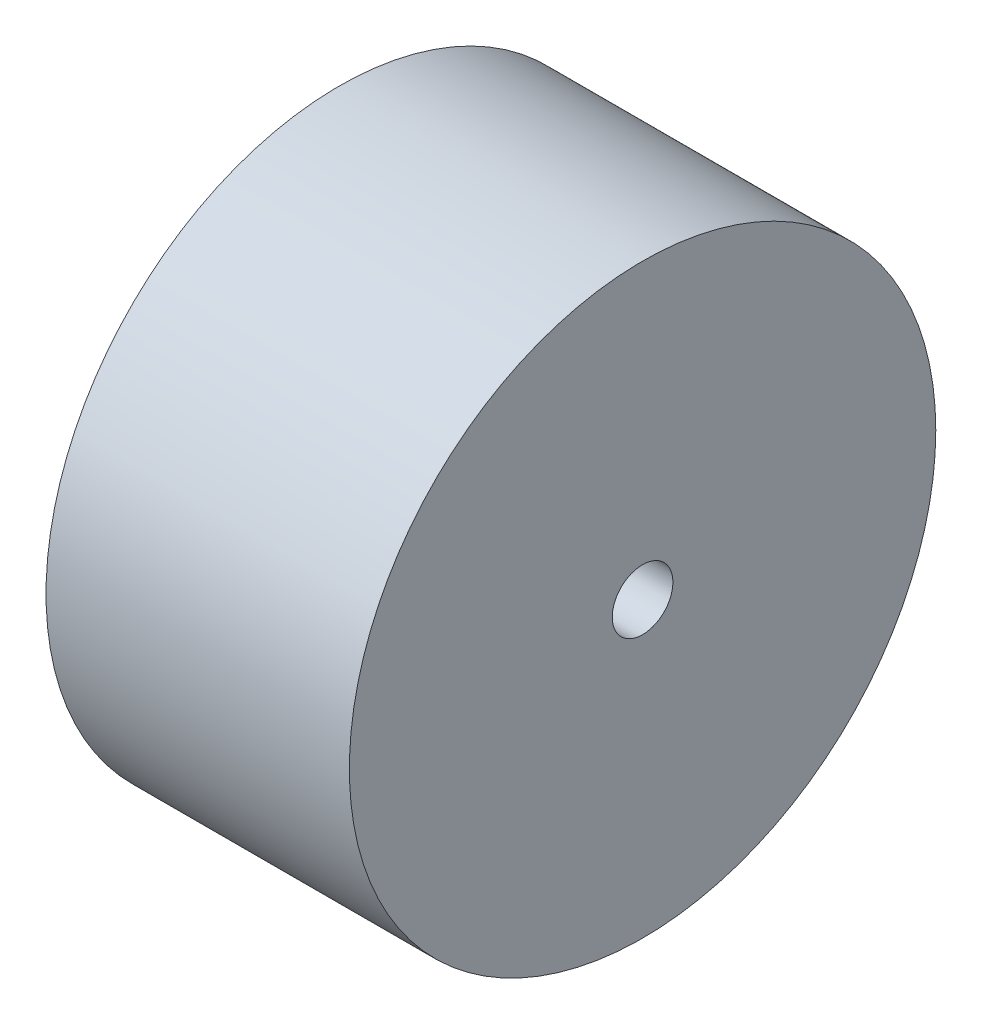
from build123d import *

# Parameters (mm, degrees)
SKETCH1_R           = 29
SKETCH1_R_2         = 3
BOSS_EXTRUDE1_DEPTH = 30


with BuildPart() as part:
    # Sketch1 → Boss-Extrude1 (new body)
    with BuildSketch(Plane(origin=(0, 0, 0), x_dir=(0, 0, -1), z_dir=(1, 0, 0))):
        Circle(SKETCH1_R)
        Circle(SKETCH1_R_2, mode=Mode.SUBTRACT)
    extrude(amount=BOSS_EXTRUDE1_DEPTH)


solid = part.part
